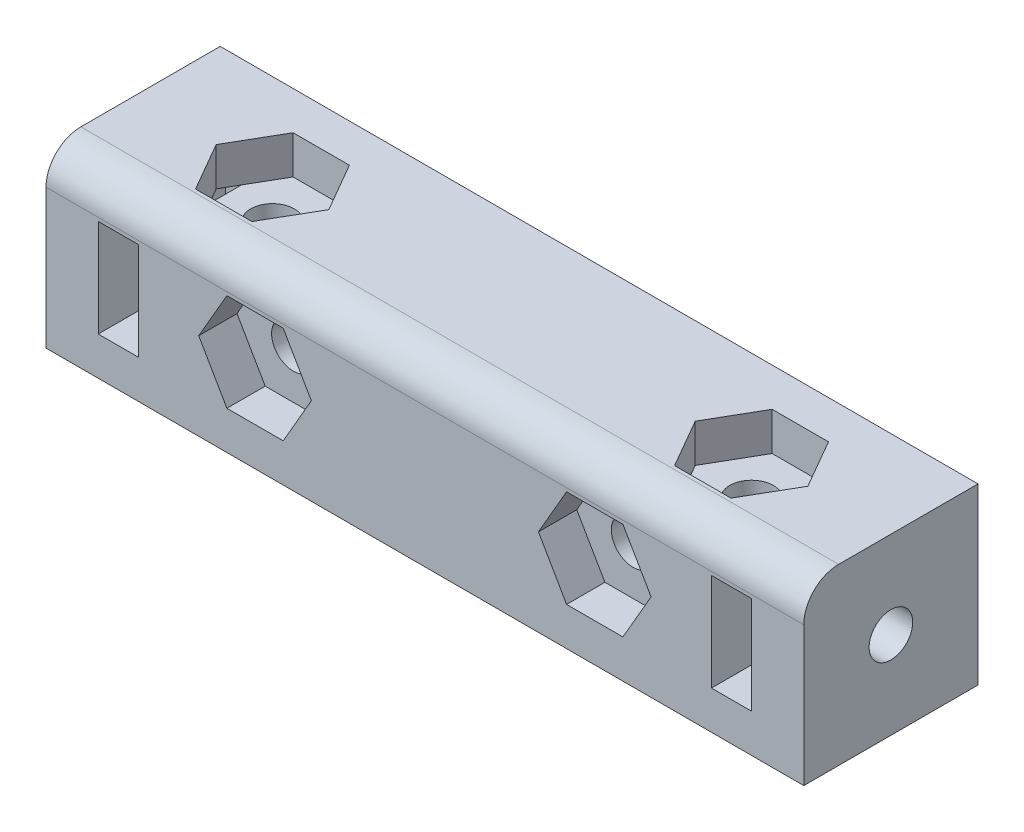
from build123d import *

# Parameters (mm, degrees)
SKETCH1_W           = 43.5
SKETCH1_H           = 10
BOSS_EXTRUDE1_DEPTH = 10
SKETCH2_R           = 1.25
CUT_EXTRUDE1_DEPTH  = 10
SKETCH3_R           = 1.25
CUT_EXTRUDE2_DEPTH  = 10
SKETCH4_R           = 1.25
CUT_EXTRUDE3_DEPTH  = 4
CUT_EXTRUDE4_START  = -4
SKETCH5_R           = 1.25
CUT_EXTRUDE4_DEPTH  = 4
CUT_EXTRUDE5_DEPTH  = 2.2
CUT_EXTRUDE6_DEPTH  = 2.2
CUT_EXTRUDE7_DEPTH  = 2.2
CUT_EXTRUDE8_DEPTH  = 2.2
SKETCH11_W          = 2.3
SKETCH11_H          = 5.6
CUT_EXTRUDE9_DEPTH  = 7.3
FILLET1_R           = 2


with BuildPart() as part:
    # Sketch1 → Boss-Extrude1 (new body)
    with BuildSketch(Plane(origin=(0, 0, 0), x_dir=(1, 0, 0), z_dir=(0, 1, 0))):
        with Locations((21.75, 5)):
            Rectangle(SKETCH1_W, SKETCH1_H)
    extrude(amount=BOSS_EXTRUDE1_DEPTH)

    # Sketch2 → Cut-Extrude1 (cut)
    with BuildSketch(Plane(origin=(0, 10, 0), x_dir=(1, 0, 0), z_dir=(0, 1, 0))):
        with Locations(Location((8, 5, 0), (0, 0, 270))):
            Circle(SKETCH2_R)
        with Locations(Location((35.5, 5, 0), (0, 0, 270))):
            Circle(SKETCH2_R)
    extrude(amount=-CUT_EXTRUDE1_DEPTH, mode=Mode.SUBTRACT)

    # Sketch3 → Cut-Extrude2 (cut)
    with BuildSketch(Plane(origin=(0, 0, -10), x_dir=(-1, 0, 0), z_dir=(0, 0, -1))):
        with Locations((-31.5, 5)):
            Circle(SKETCH3_R)
        with Locations((-12, 5)):
            Circle(SKETCH3_R)
    extrude(amount=-CUT_EXTRUDE2_DEPTH, mode=Mode.SUBTRACT)

    # Sketch4 → Cut-Extrude3 (cut)
    with BuildSketch(Plane(origin=(43.5, 0, 0), x_dir=(0, 0, -1), z_dir=(1, 0, 0))):
        with Locations((5, 5)):
            Circle(SKETCH4_R)
    extrude(amount=-CUT_EXTRUDE3_DEPTH, mode=Mode.SUBTRACT)

    # Sketch5 → Cut-Extrude4 (cut)
    with BuildSketch(Plane.ZY.offset(CUT_EXTRUDE4_START)):
        with Locations(Location((-5, 5, 0), (0, 0, 180))):
            Circle(SKETCH5_R)
    extrude(amount=CUT_EXTRUDE4_DEPTH, mode=Mode.SUBTRACT)

    # Sketch6 → Cut-Extrude5 (cut)
    with BuildSketch(Plane(origin=(0, 10, 0), x_dir=(1, 0, 0), z_dir=(0, 1, 0))):
        Polygon((9.616580754, 2.2), (11.233161507, 5), (9.616580754, 7.8), (6.383419246, 7.8), (4.766838493, 5), (6.383419246, 2.2), align=None)
    extrude(amount=-CUT_EXTRUDE5_DEPTH, mode=Mode.SUBTRACT)

    # Sketch7 → Cut-Extrude6 (cut)
    with BuildSketch(Plane(origin=(0, 10, 0), x_dir=(1, 0, 0), z_dir=(0, 1, 0))):
        Polygon((33.883419246, 7.8), (32.266838493, 5), (33.883419246, 2.2), (37.116580754, 2.2), (38.733161507, 5), (37.116580754, 7.8), align=None)
    extrude(amount=-CUT_EXTRUDE6_DEPTH, mode=Mode.SUBTRACT)

    # Sketch8 → Cut-Extrude7 (cut)
    with BuildSketch(Plane.XY):
        Polygon((10.383419246, 2.2), (13.616580754, 2.2), (15.233161507, 5), (13.616580754, 7.8), (10.383419246, 7.8), (8.766838493, 5), align=None)
    extrude(amount=-CUT_EXTRUDE7_DEPTH, mode=Mode.SUBTRACT)

    # Sketch9 → Cut-Extrude8 (cut)
    with BuildSketch(Plane.XY):
        Polygon((33.116580754, 7.8), (29.883419246, 7.8), (28.266838493, 5), (29.883419246, 2.2), (33.116580754, 2.2), (34.733161507, 5), align=None)
    extrude(amount=-CUT_EXTRUDE8_DEPTH, mode=Mode.SUBTRACT)

    # Sketch11 → Cut-Extrude9 (cut)
    with BuildSketch(Plane.XY):
        with Locations((4.15, 5)):
            Rectangle(SKETCH11_W, SKETCH11_H)
        with Locations((39.35, 5)):
            Rectangle(SKETCH11_W, SKETCH11_H)
    extrude(amount=-CUT_EXTRUDE9_DEPTH, mode=Mode.SUBTRACT)

    # Fillet1
    fillet1_edges = [part.edges().sort_by_distance(p)[0] for p in [
        (21.75, 10, 0),
    ]]
    fillet(fillet1_edges, radius=FILLET1_R)


solid = part.part
